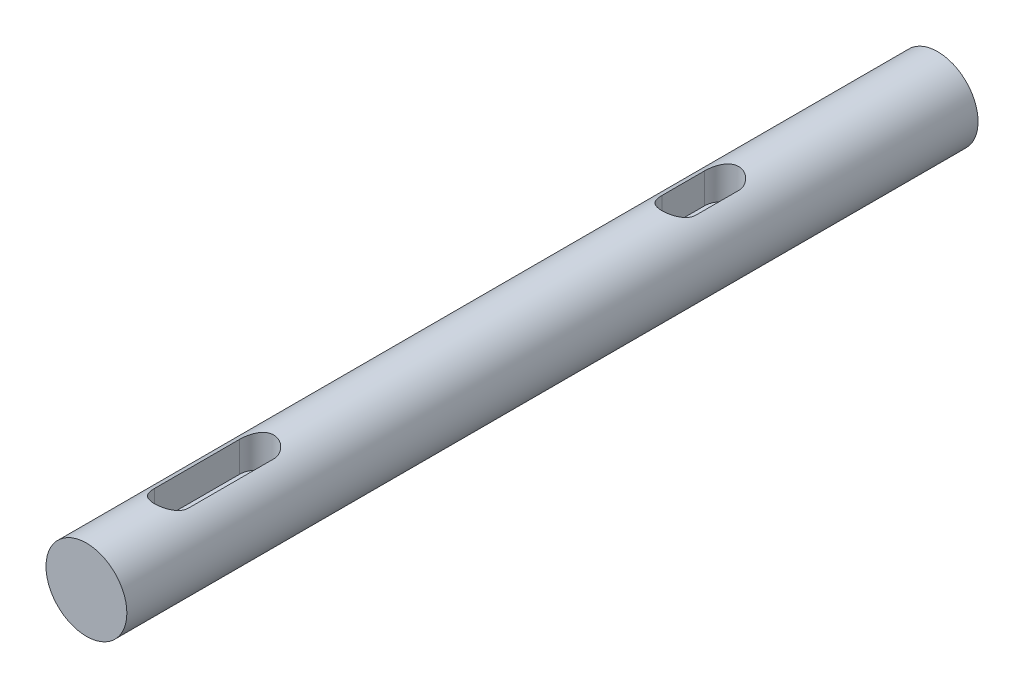
from build123d import *

# Parameters (mm, degrees)
SKETCH1_R           = 4.75
BOSS_EXTRUDE1_DEPTH = 0.0001
BOSS_EXTRUDE2_START = 105
SKETCH4_R           = 4.75
BOSS_EXTRUDE2_DEPTH = 105
CUT_EXTRUDE3_DEPTH  = 4
SKETCH6_R           = 4.75
CUT_EXTRUDE4_DEPTH  = 5


with BuildPart() as part:
    # Sketch1 → Boss-Extrude1 (new body)
    with BuildSketch(Plane.XY):
        Circle(SKETCH1_R)
    extrude(amount=BOSS_EXTRUDE1_DEPTH)

    # Sketch4 → Boss-Extrude2 (add)
    with BuildSketch(Plane(origin=(0, 0, 0), x_dir=(-1, 0, 0), z_dir=(0, 0, -1)).offset(BOSS_EXTRUDE2_START)):
        Circle(SKETCH4_R)
    extrude(amount=-BOSS_EXTRUDE2_DEPTH)

    # Sketch5 → Cut-Extrude3 (cut)
    with BuildSketch(Plane(origin=(0, 4.75, 0), x_dir=(1, 0, 0), z_dir=(0, 1, 0))):
        with BuildLine():
            Line((-2, 10), (-2, 20))
            ThreePointArc((-2, 20), (0, 22), (2, 20))
            Line((2, 20), (2, 10))
            ThreePointArc((2, 10), (0, 8), (-2, 10))
        make_face()
        with BuildLine():
            Line((-2, 69.62), (-2, 74.62))
            ThreePointArc((-2, 74.62), (0, 76.62), (2, 74.62))
            Line((2, 74.62), (2, 69.62))
            ThreePointArc((2, 69.62), (0, 67.62), (-2, 69.62))
        make_face()
    extrude(amount=-CUT_EXTRUDE3_DEPTH, mode=Mode.SUBTRACT)

    # Sketch6 → Cut-Extrude4 (cut)
    with BuildSketch(Plane(origin=(0, 0, -105), x_dir=(-1, 0, 0), z_dir=(0, 0, -1))):
        Circle(SKETCH6_R)
    extrude(amount=-CUT_EXTRUDE4_DEPTH, mode=Mode.SUBTRACT)


solid = part.part
